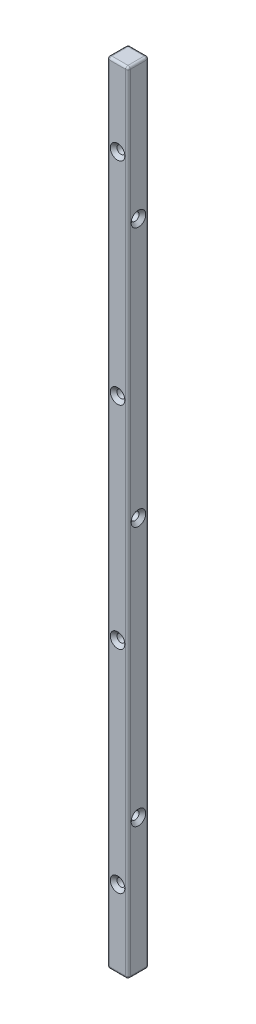
from build123d import *

# Parameters (mm, degrees)
SKETCH2_W                                            = 9
SKETCH2_H                                            = 9
RAIL_DEPTH                                           = 340.5
ROUNDED_EDGES_R                                      = 1
CSK_FOR_M3_FLAT_HEAD_MACHINE_SCREW1_D                = 3.4
CSK_FOR_M3_FLAT_HEAD_MACHINE_SCREW1_CSINK_D          = 6.3
CSK_FOR_M3_FLAT_HEAD_MACHINE_SCREW1_CSINK_ANGLE      = 90
CSK_FOR_M3_FLAT_HEAD_MACHINE_SCREW1_ON_F_D           = 3.4
CSK_FOR_M3_FLAT_HEAD_MACHINE_SCREW1_ON_F_CSINK_D     = 6.3
CSK_FOR_M3_FLAT_HEAD_MACHINE_SCREW1_ON_F_CSINK_ANGLE = 90


with BuildPart() as part:
    # Sketch2 → Rail (new body)
    with BuildSketch(Plane(origin=(0, 0, 0), x_dir=(1, 0, 0), z_dir=(0, 1, 0))):
        Rectangle(SKETCH2_W, SKETCH2_H)
    extrude(amount=RAIL_DEPTH)

    # Rounded Edges
    rounded_edges_edges = [part.edges().sort_by_distance(p)[0] for p in [
        (-4.5, 340.5, 0),
        (0, 340.5, 4.5),
        (4.5, 340.5, 0),
        (0, 0, 4.5),
        (-4.5, 0, 0),
        (0, 0, -4.5),
        (4.5, 0, 0),
        (0, 340.5, -4.5),
        (4.5, 170.25, 4.5),
        (-4.5, 170.25, 4.5),
        (-4.5, 170.25, -4.5),
        (4.5, 170.25, -4.5),
    ]]
    fillet(rounded_edges_edges, radius=ROUNDED_EDGES_R)

    # CSK for M3 Flat Head Machine Screw1 (through all)
    with Locations(Plane(origin=(4.5, 58.5, 0), x_dir=(0, 0, 1), z_dir=(1, 0, 0))):
        with Locations((0, 0), (0, -111.75), (0, -223.5)):
            CounterSinkHole(CSK_FOR_M3_FLAT_HEAD_MACHINE_SCREW1_D / 2, CSK_FOR_M3_FLAT_HEAD_MACHINE_SCREW1_CSINK_D / 2, counter_sink_angle=CSK_FOR_M3_FLAT_HEAD_MACHINE_SCREW1_CSINK_ANGLE)

    # CSK for M3 Flat Head Machine Screw1 on f (through all)
    with Locations(Plane(origin=(0, 307, 4.5), x_dir=(1, 0, 0), z_dir=(0, 0, 1))):
        with Locations((0, 0), (0, -91.166666667), (0, -182.333333333), (0, -273.5)):
            CounterSinkHole(CSK_FOR_M3_FLAT_HEAD_MACHINE_SCREW1_ON_F_D / 2, CSK_FOR_M3_FLAT_HEAD_MACHINE_SCREW1_ON_F_CSINK_D / 2, counter_sink_angle=CSK_FOR_M3_FLAT_HEAD_MACHINE_SCREW1_ON_F_CSINK_ANGLE)


solid = part.part
